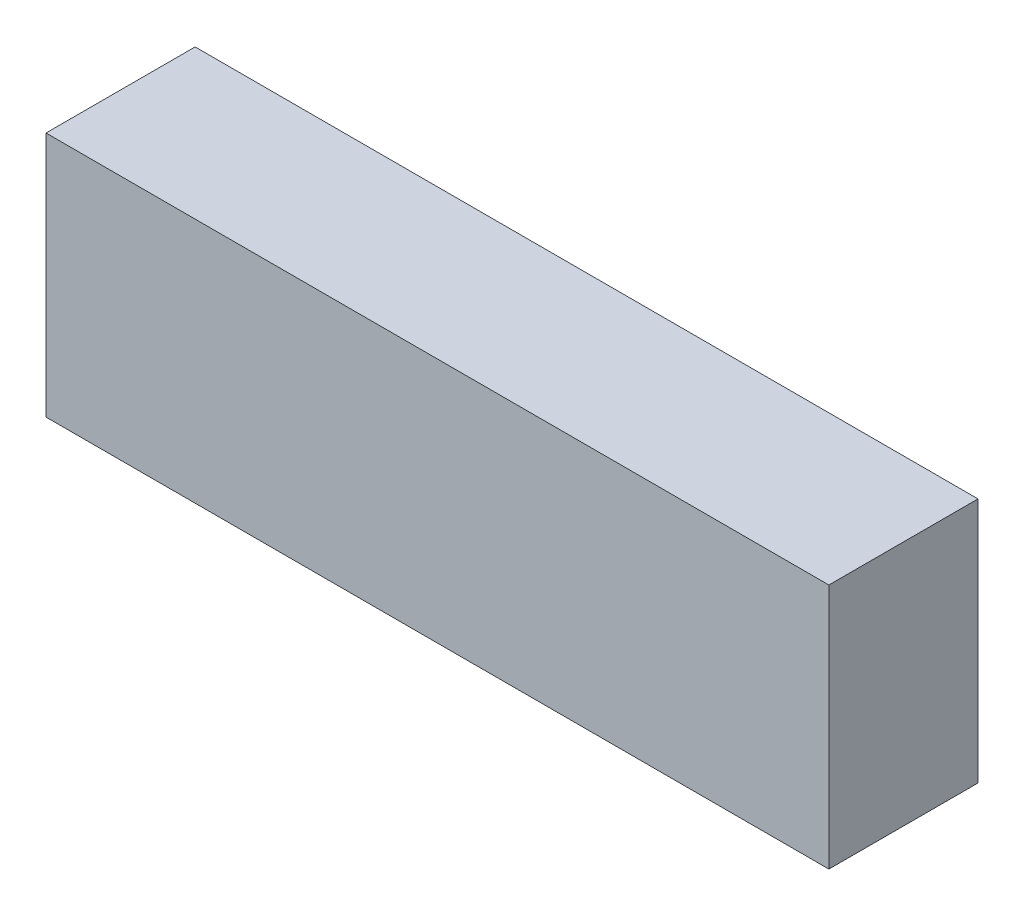
from build123d import *

# Parameters (mm, degrees)
SKETCH_1_W      = 105
SKETCH_1_H      = 33
EXTRUDE_1_DEPTH = 20


with BuildPart() as part:
    # 草图1 → 凸台-拉伸1 (new body)
    with BuildSketch(Plane.XY):
        with Locations((8.279510022, -10.787305122)):
            Rectangle(SKETCH_1_W, SKETCH_1_H)
    extrude(amount=EXTRUDE_1_DEPTH)


solid = part.part
